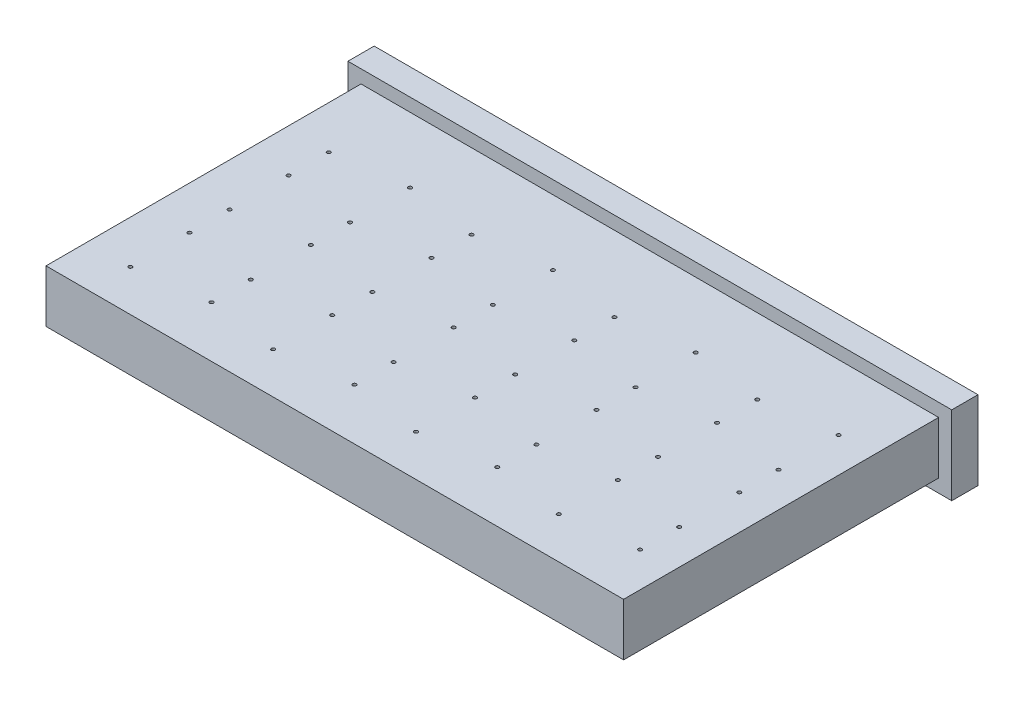
from build123d import *

# Parameters (mm, degrees)
SKETCH1_W           = 292.1
SKETCH1_H           = 38.1
BOSS_EXTRUDE1_DEPTH = 12.7
SKETCH2_W           = 279.4
SKETCH2_H           = 25.4
BOSS_EXTRUDE2_DEPTH = 152.4
SKETCH4_R           = 0.875
CUT_EXTRUDE1_DEPTH  = 223.703109543


with BuildPart() as part:
    # Sketch1 → Boss-Extrude1 (new body)
    with BuildSketch(Plane.XY):
        Rectangle(SKETCH1_W, SKETCH1_H)
    extrude(amount=BOSS_EXTRUDE1_DEPTH)

    # Sketch2 → Boss-Extrude2 (add)
    with BuildSketch(Plane.XY.offset(12.7)):
        Rectangle(SKETCH2_W, SKETCH2_H)
    extrude(amount=BOSS_EXTRUDE2_DEPTH)

    # Sketch4 → Cut-Extrude1 (cut, through all)
    with BuildSketch(Plane.XZ.offset(12.7)):
        with Locations(Location((-118.894764252, 116.542067709, 0), (0, 0, 270))):
            Circle(SKETCH4_R)
        with Locations(Location((-118.894764252, 68.536067709, 0), (0, 0, 270))):
            Circle(SKETCH4_R)
        with Locations(Location((-84.394764252, 73.351013878, 0), (0, 0, 270))):
            Circle(SKETCH4_R)
        with Locations(Location((-118.894764252, 49.10609229, 0), (0, 0, 270))):
            Circle(SKETCH4_R)
        with Locations(Location((-84.394764252, 44.291146122, 0), (0, 0, 270))):
            Circle(SKETCH4_R)
        with Locations(Location((-49.806764252, 68.536067709, 0), (0, 0, 270))):
            Circle(SKETCH4_R)
        with Locations(Location((-49.806764252, 116.542067709, 0), (0, 0, 270))):
            Circle(SKETCH4_R)
        with Locations(Location((-49.806764252, 145.10793229, 0), (0, 0, 270))):
            Circle(SKETCH4_R)
        with Locations(Location((-15.306764252, 44.291146122, 0), (0, 0, 270))):
            Circle(SKETCH4_R)
        with Locations(Location((-15.306764252, 73.351013878, 0), (0, 0, 270))):
            Circle(SKETCH4_R)
        with Locations(Location((19.281235748, 116.542067709, 0), (0, 0, 270))):
            Circle(SKETCH4_R)
        with Locations(Location((19.281235748, 145.10793229, 0), (0, 0, 270))):
            Circle(SKETCH4_R)
        with Locations(Location((53.781235748, 121.357013878, 0), (0, 0, 270))):
            Circle(SKETCH4_R)
        with Locations(Location((122.869235748, 92.292066122, 0), (0, 0, 270))):
            Circle(SKETCH4_R)
        with Locations(Location((88.369235748, 68.536067709, 0), (0, 0, 270))):
            Circle(SKETCH4_R)
        with Locations(Location((88.369235748, 49.10609229, 0), (0, 0, 270))):
            Circle(SKETCH4_R)
        with Locations(Location((122.869235748, 44.291146122, 0), (0, 0, 270))):
            Circle(SKETCH4_R)
        with Locations(Location((122.869235748, 73.351013878, 0), (0, 0, 270))):
            Circle(SKETCH4_R)
        with Locations(Location((88.369235748, 97.10701229, 0), (0, 0, 270))):
            Circle(SKETCH4_R)
        with Locations(Location((-118.894764252, 145.10793229, 0), (0, 0, 270))):
            Circle(SKETCH4_R)
        with Locations(Location((-84.394764252, 140.292986122, 0), (0, 0, 270))):
            Circle(SKETCH4_R)
        with Locations(Location((-84.394764252, 121.357013878, 0), (0, 0, 270))):
            Circle(SKETCH4_R)
        with Locations(Location((-118.894764252, 97.10701229, 0), (0, 0, 270))):
            Circle(SKETCH4_R)
        with Locations(Location((-84.394764252, 92.292066122, 0), (0, 0, 270))):
            Circle(SKETCH4_R)
        with Locations(Location((-49.806764252, 49.10609229, 0), (0, 0, 270))):
            Circle(SKETCH4_R)
        with Locations(Location((-49.806764252, 97.10701229, 0), (0, 0, 270))):
            Circle(SKETCH4_R)
        with Locations(Location((-15.306764252, 140.292986122, 0), (0, 0, 270))):
            Circle(SKETCH4_R)
        with Locations(Location((-15.306764252, 92.292066122, 0), (0, 0, 270))):
            Circle(SKETCH4_R)
        with Locations(Location((19.281235748, 49.10609229, 0), (0, 0, 270))):
            Circle(SKETCH4_R)
        with Locations(Location((19.281235748, 68.536067709, 0), (0, 0, 270))):
            Circle(SKETCH4_R)
        with Locations(Location((19.281235748, 97.10701229, 0), (0, 0, 270))):
            Circle(SKETCH4_R)
        with Locations(Location((53.781235748, 140.292986122, 0), (0, 0, 270))):
            Circle(SKETCH4_R)
        with Locations(Location((88.369235748, 145.10793229, 0), (0, 0, 270))):
            Circle(SKETCH4_R)
        with Locations(Location((122.869235748, 140.292986122, 0), (0, 0, 270))):
            Circle(SKETCH4_R)
        with Locations(Location((122.869235748, 121.357013878, 0), (0, 0, 270))):
            Circle(SKETCH4_R)
        with Locations(Location((88.369235748, 116.542067709, 0), (0, 0, 270))):
            Circle(SKETCH4_R)
        with Locations(Location((53.781235748, 44.291146122, 0), (0, 0, 270))):
            Circle(SKETCH4_R)
        with Locations(Location((53.781235748, 92.292066122, 0), (0, 0, 270))):
            Circle(SKETCH4_R)
        with Locations(Location((53.781235748, 73.351013878, 0), (0, 0, 270))):
            Circle(SKETCH4_R)
        with Locations(Location((-15.306764252, 121.357013878, 0), (0, 0, 270))):
            Circle(SKETCH4_R)
    extrude(amount=-CUT_EXTRUDE1_DEPTH, mode=Mode.SUBTRACT)


solid = part.part
